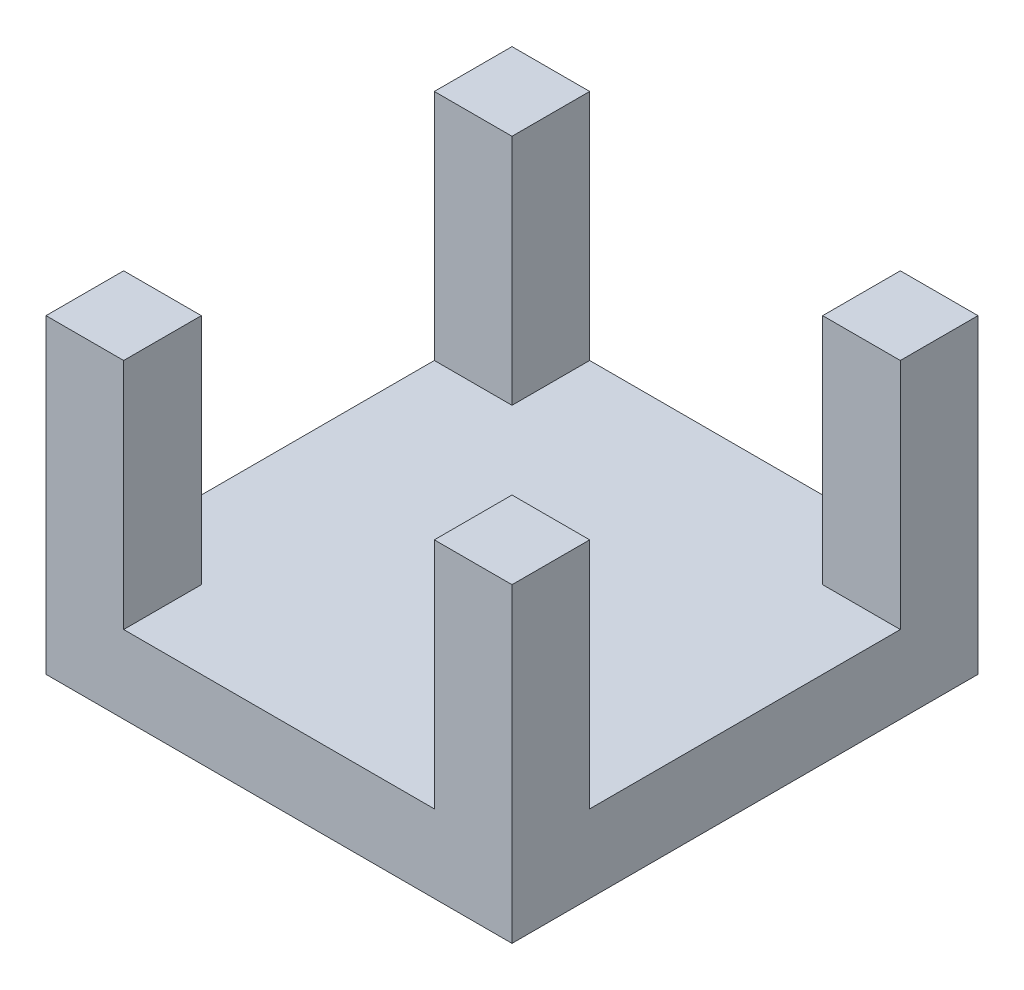
from build123d import *

# Parameters (mm, degrees)
SKETCH_1_W          = 600
SKETCH_1_H          = 600
EXTRUDE_1_DEPTH     = 400
CUT_EXTRUDE_1_DEPTH = 300
SKETCH_3_R          = 60
SKETCH_3_R_2        = 50
EXTRUDE_2_DEPTH     = 10


with BuildPart() as part:
    # 草图1 → 凸台-拉伸1 (new body)
    with BuildSketch(Plane(origin=(0, 0, 0), x_dir=(1, 0, 0), z_dir=(0, 1, 0))):
        Rectangle(SKETCH_1_W, SKETCH_1_H)
    extrude(amount=EXTRUDE_1_DEPTH)

    # 草图2 → 切除-拉伸1 (cut)
    with BuildSketch(Plane(origin=(0, 400, 0), x_dir=(1, 0, 0), z_dir=(0, 1, 0))):
        Polygon((-500, 200), (-200, 200), (-200, 500), (200, 500), (200, 200), (500, 200), (500, -200), (200, -200), (200, -500), (-200, -500), (-200, -200), (-500, -200), align=None)
    extrude(amount=-CUT_EXTRUDE_1_DEPTH, mode=Mode.SUBTRACT)

    # 草图3 → 凸台-拉伸2 (add)
    with BuildSketch(Plane.XZ):
        with Locations(Location((0, -200, 0), (0, 0, 90))):
            Circle(SKETCH_3_R)
        with Locations(Location((0, -200, 0), (0, 0, 270))):
            Circle(SKETCH_3_R_2, mode=Mode.SUBTRACT)
    extrude(amount=EXTRUDE_2_DEPTH)


solid = part.part
